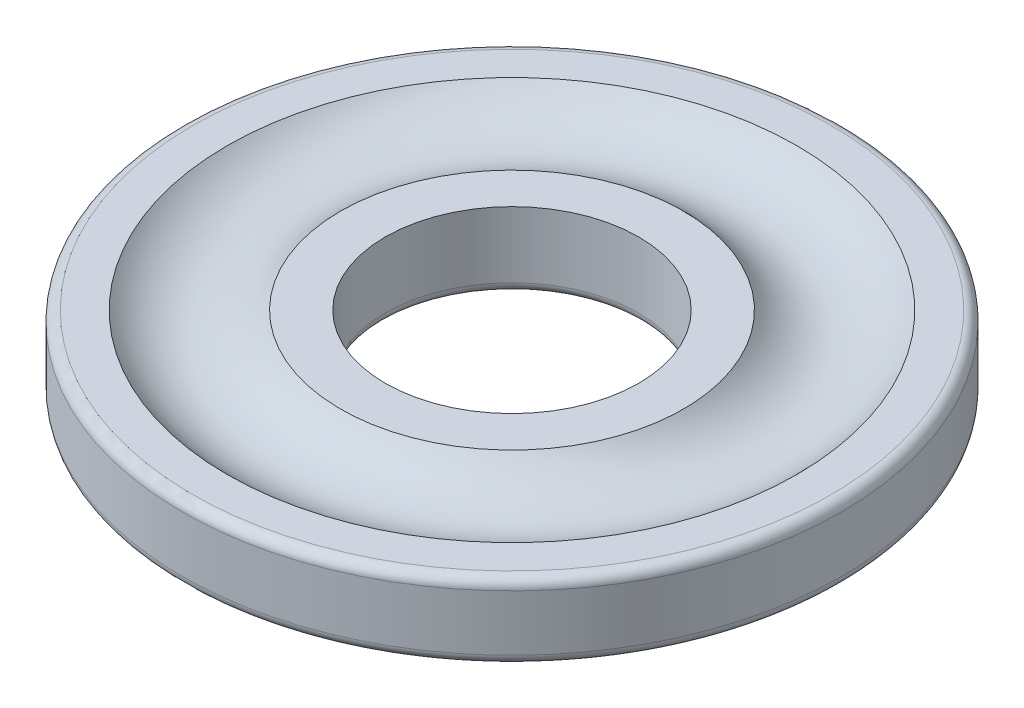
from build123d import *

# Parameters (mm, degrees)
FILLET1_R = 0.4


with BuildPart() as part:
    # Sketch1 → Revolve1 (revolve)
    with BuildSketch(Plane.XY):
        with BuildLine():
            Line((5, -2), (5, -5))
            Line((5, -5), (13, -5))
            Line((13, -5), (13, -2))
            Line((13, -2), (11.236067977, -2))
            ThreePointArc((11.236067977, -2), (9, -3), (6.763932023, -2))
            Line((6.763932023, -2), (5, -2))
        make_face()
    revolve(axis=Axis((0, 5, 0), (0, -1, 0)))

    # Fillet1
    fillet1_edges = [part.edges().sort_by_distance(p)[0] for p in [
        (-13, -5, 0),
        (-13, -2, 0),
        (-5, -5, 0),
    ]]
    fillet(fillet1_edges, radius=FILLET1_R)


solid = part.part
